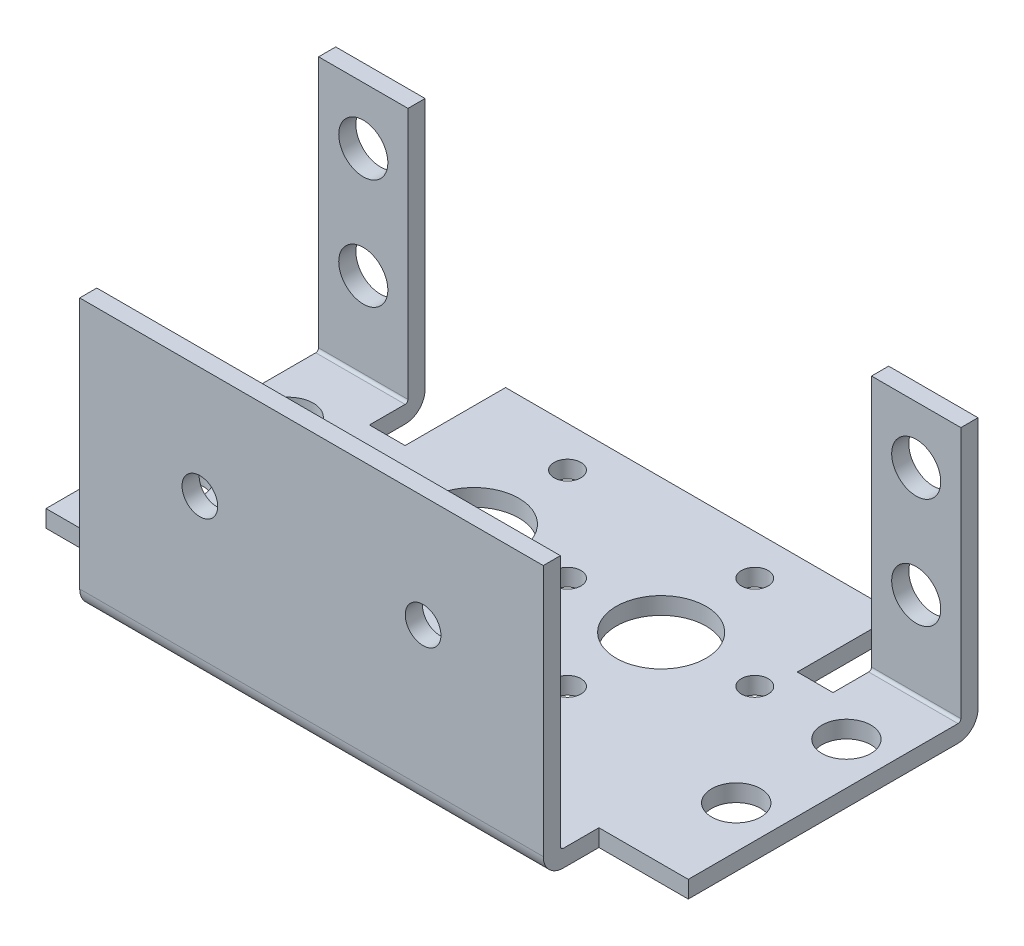
from build123d import *

# Parameters (mm, degrees)
SKETCH1_R      = 1.1938
SKETCH1_R_2    = 2.1844
SKETCH1_R_3    = 4.0005
EXTRUDE1_DEPTH = 1.524
EXTRUDE3_START = -13.3731
SKETCH3_W      = 7.9502
SKETCH3_H      = 24.2062
SKETCH3_R      = 2.1844
EXTRUDE3_DEPTH = 1.524
EXTRUDE4_START = 15.8369
SKETCH3_3_W    = 41.2496
SKETCH3_3_H    = 24.2062
SKETCH3_3_R    = 1.5875
EXTRUDE4_DEPTH = 1.524
FILLET4_R      = 1.778
FILLET5_R      = 0.254


with BuildPart() as part:
    # Sketch1 → Extrude1 (new body)
    # profile 1 of 2: a face of its own
    with BuildSketch(Plane(origin=(0, 0, 0), x_dir=(1, 0, 0), z_dir=(0, 1, 0))):
        Polygon((28.575, 0), (28.575, -12.4079), (20.6248, -12.4079), (20.6248, -17.3609), (-20.6248, -17.3609), (-20.6248, -12.4079), (-28.575, -12.4079), (-28.575, 0), align=None)
        with Locations(Location((8.3312, -2.9083, 0), (0, 0, 90))):
            Circle(SKETCH1_R, mode=Mode.SUBTRACT)
        with Locations(Location((-8.3312, -2.9083, 0), (0, 0, 90))):
            Circle(SKETCH1_R, mode=Mode.SUBTRACT)
        with Locations(Location((-24.8158, -4.3815, 0), (0, 0, 90))):
            Circle(SKETCH1_R_2, mode=Mode.SUBTRACT)
        with Locations(Location((24.8158, -4.3815, 0), (0, 0, 90))):
            Circle(SKETCH1_R_2, mode=Mode.SUBTRACT)
    # profile 2 of 2: a face of its own
    with BuildSketch(Plane(origin=(0, 0, 0), x_dir=(1, 0, 0), z_dir=(0, 1, 0))):
        Polygon((28.575, 0), (-28.575, 0), (-28.575, 13.3731), (-20.6248, 13.3731), (-20.6248, 8.4201), (-17.4498, 8.4201), (-17.4498, 17.3609), (17.4498, 17.3609), (17.4498, 8.4201), (20.6248, 8.4201), (20.6248, 13.3731), (28.575, 13.3731), align=None)
        with Locations(Location((8.3312, 5.4229, 0), (0, 0, 90))):
            Circle(SKETCH1_R_3, mode=Mode.SUBTRACT)
        with Locations(Location((8.3312, 13.7541, 0), (0, 0, 90))):
            Circle(SKETCH1_R, mode=Mode.SUBTRACT)
        with Locations(Location((-8.3312, 5.4229, 0), (0, 0, 90))):
            Circle(SKETCH1_R_3, mode=Mode.SUBTRACT)
        with Locations(Location((-24.8158, 5.4229, 0), (0, 0, 90))):
            Circle(SKETCH1_R_2, mode=Mode.SUBTRACT)
        with Locations(Location((-16.6624, 5.4229, 0), (0, 0, 90))):
            Circle(SKETCH1_R, mode=Mode.SUBTRACT)
        with Locations(Location((-8.3312, 13.7541, 0), (0, 0, 90))):
            Circle(SKETCH1_R, mode=Mode.SUBTRACT)
        with Locations(Location((0, 5.4229, 0), (0, 0, 90))):
            Circle(SKETCH1_R, mode=Mode.SUBTRACT)
        with Locations(Location((16.6624, 5.4229, 0), (0, 0, 90))):
            Circle(SKETCH1_R, mode=Mode.SUBTRACT)
        with Locations(Location((24.8158, 5.4229, 0), (0, 0, 90))):
            Circle(SKETCH1_R_2, mode=Mode.SUBTRACT)
    extrude(amount=EXTRUDE1_DEPTH)

    # Sketch3 → Extrude3 (add)
    # profile 1 of 2: a face of its own
    with BuildSketch(Plane.XY.offset(EXTRUDE3_START)):
        with Locations((-24.5999, 12.1031)):
            Rectangle(SKETCH3_W, SKETCH3_H)
        with Locations(Location((-24.5999, 19.1262, 0), (0, 0, 180))):
            Circle(SKETCH3_R, mode=Mode.SUBTRACT)
        with Locations(Location((-24.5999, 9.3218, 0), (0, 0, 180))):
            Circle(SKETCH3_R, mode=Mode.SUBTRACT)
    # profile 2 of 2: a face of its own
    with BuildSketch(Plane.XY.offset(EXTRUDE3_START)):
        with Locations((24.5999, 12.1031)):
            Rectangle(SKETCH3_W, SKETCH3_H)
        with Locations(Location((24.5999, 9.3218, 0), (0, 0, 180))):
            Circle(SKETCH3_R, mode=Mode.SUBTRACT)
        with Locations(Location((24.5999, 19.1262, 0), (0, 0, 180))):
            Circle(SKETCH3_R, mode=Mode.SUBTRACT)
    extrude(amount=EXTRUDE3_DEPTH)

    # Sketch3<3> → Extrude4 (add)
    with BuildSketch(Plane.XY.offset(EXTRUDE4_START)):
        with Locations((0, 12.1031)):
            Rectangle(SKETCH3_3_W, SKETCH3_3_H)
        with Locations((-9.9314, 14.2748)):
            Circle(SKETCH3_3_R, mode=Mode.SUBTRACT)
        with Locations((9.9314, 14.2748)):
            Circle(SKETCH3_3_R, mode=Mode.SUBTRACT)
    extrude(amount=EXTRUDE4_DEPTH)

    # Fillet4
    fillet4_edges = [part.edges().sort_by_distance(p)[0] for p in [
        (0, 0, 17.3609),
        (-24.5999, 0, -13.3731),
        (24.5999, 0, -13.3731),
    ]]
    fillet(fillet4_edges, radius=FILLET4_R)

    # Fillet5
    fillet5_edges = [part.edges().sort_by_distance(p)[0] for p in [
        (24.5999, 1.524, -11.8491),
        (0, 1.524, 15.8369),
        (-24.5999, 1.524, -11.8491),
    ]]
    fillet(fillet5_edges, radius=FILLET5_R)


solid = part.part
